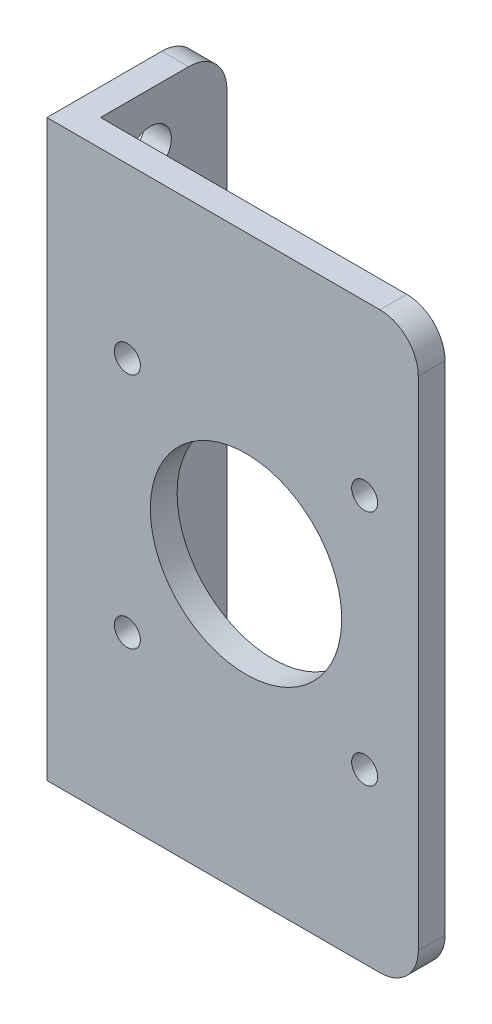
from build123d import *

# Parameters (mm, degrees)
BOSS_EXTRUDE1_DEPTH  = 37.5
M3_CLEARANCE_HOLE1_D = 3.4
SKETCH4_R            = 12.5
CUT_EXTRUDE1_DEPTH   = 64.488187878
M5_CLEARANCE_HOLE1_D = 5.5
FILLET1_R            = 5


with BuildPart() as part:
    # Sketch1 → Boss-Extrude1 (new, symmetric)
    with BuildSketch(Plane(origin=(0, 0, 0), x_dir=(1, 0, 0), z_dir=(0, 1, 0))):
        Polygon((0, 0), (0, 20), (3.5, 20), (3.5, 3.5), (48.5, 3.5), (48.5, 0), align=None)
    extrude(amount=BOSS_EXTRUDE1_DEPTH, both=True)

    # M3 Clearance Hole1 (through all)
    with Locations(Plane(origin=(0, 0, -3.5), x_dir=(-1, 0, 0), z_dir=(0, 0, -1))):
        with Locations((-41.5, 15.5), (-10.5, 15.5), (-10.5, -15.5), (-41.5, -15.5)):
            Hole(M3_CLEARANCE_HOLE1_D / 2)

    # Sketch4 → Cut-Extrude1 (cut, through all)
    with BuildSketch(Plane(origin=(0, 0, -3.5), x_dir=(-1, 0, 0), z_dir=(0, 0, -1))):
        with Locations((-26, 0)):
            Circle(SKETCH4_R)
    extrude(amount=-CUT_EXTRUDE1_DEPTH, mode=Mode.SUBTRACT)

    # M5 Clearance Hole1 (through all)
    with Locations(Plane.ZY):
        with Locations((-10, 30.5), (-10, -30.5)):
            Hole(M5_CLEARANCE_HOLE1_D / 2)

    # Fillet1
    fillet1_edges = [part.edges().sort_by_distance(p)[0] for p in [
        (1.75, 37.5, -20),
        (1.75, -37.5, -20),
        (48.5, -37.5, -1.75),
        (48.5, 37.5, -1.75),
    ]]
    fillet(fillet1_edges, radius=FILLET1_R)


solid = part.part
